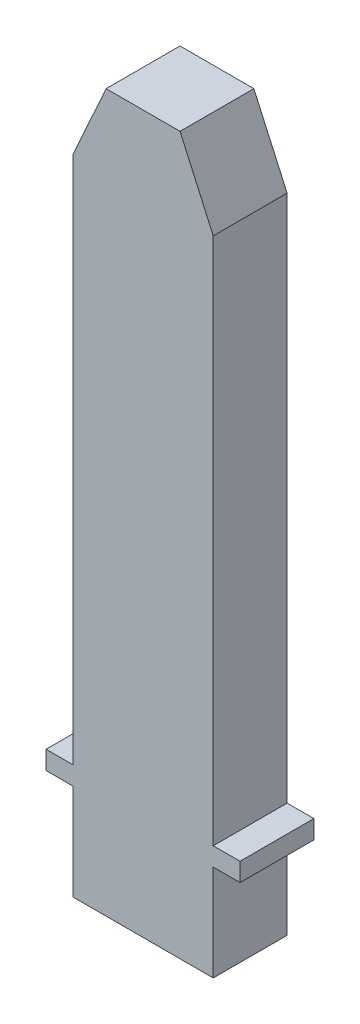
from build123d import *

# Parameters (mm, degrees)
BOSS_EXTRUDE1_DEPTH = 2


with BuildPart() as part:
    # Sketch1 → Boss-Extrude1 (new body)
    with BuildSketch(Plane.XY):
        Polygon((1.9, 0), (2.625, 0), (2.625, -0.5), (1.9, -0.5), (1.9, -3.1), (-1.9, -3.1), (-1.9, -0.5), (-2.625, -0.5), (-2.625, 0), (-1.9, 0), (-1.9, 14.3), (-1, 16.3), (1, 16.3), (1.9, 14.3), align=None)
    extrude(amount=BOSS_EXTRUDE1_DEPTH)


solid = part.part
